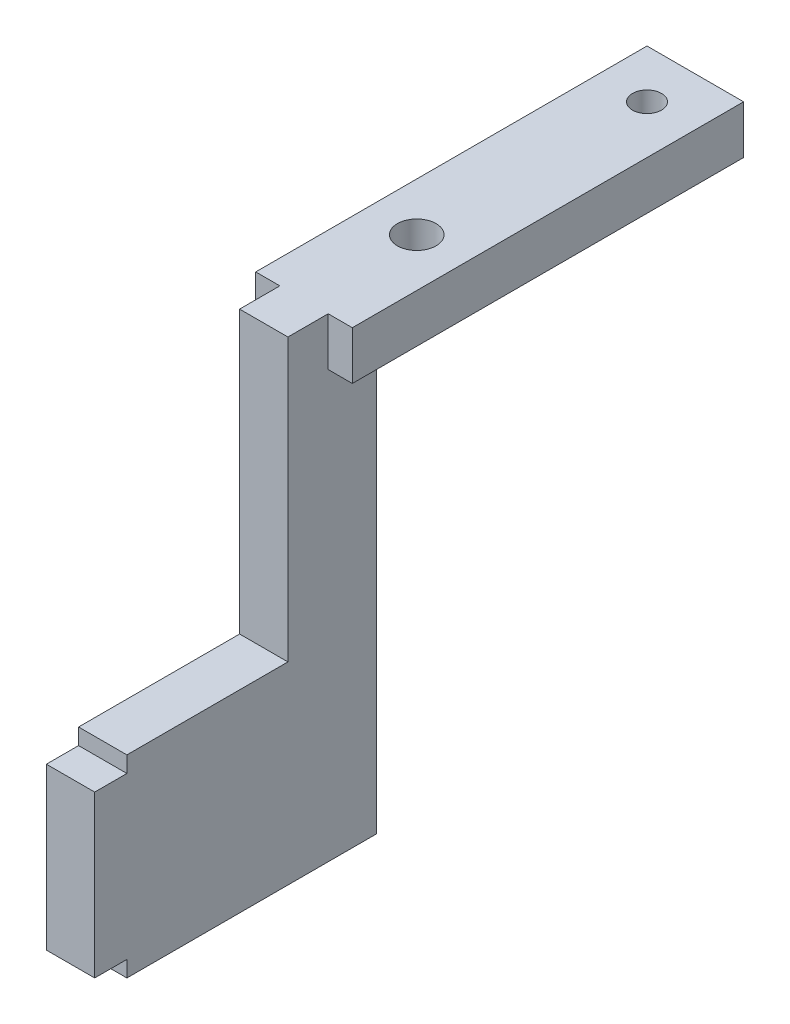
from build123d import *

# Parameters (mm, degrees)
BOSS_EXTRUDE1_START     = 7.2
SKETCH1_W               = 6
SKETCH1_H               = 3
BOSS_EXTRUDE1_DEPTH     = 24.3
BOSS_EXTRUDE2_START     = 28.5
SKETCH2_W               = 3
SKETCH2_H               = 29.475
BOSS_EXTRUDE2_DEPTH     = 17.5
CUT_EXTRUDE1_DEPTH      = 56.675089807
CUT_EXTRUDE1_DEPTH_BACK = 56.675089807
SKETCH3_R               = 1.2
SKETCH3_R_2             = 0.9
CUT_EXTRUDE2_DEPTH      = 56.675089807
CUT_EXTRUDE2_DEPTH_BACK = 56.675089807
SKETCH4_W               = 13
SKETCH4_H               = 18.475
CUT_EXTRUDE3_DEPTH      = 56.675089807
CUT_EXTRUDE3_DEPTH_BACK = 56.675089807
SKETCH5_W               = 3
SKETCH5_H               = 2.5


with BuildPart() as part:
    # Sketch1 → Boss-Extrude1 (new body)
    with BuildSketch(Plane.XY.offset(BOSS_EXTRUDE1_START)):
        with Locations((17.8, 21.975)):
            Rectangle(SKETCH1_W, SKETCH1_H)
    extrude(amount=BOSS_EXTRUDE1_DEPTH)

    # Sketch2 → Boss-Extrude2 (add)
    with BuildSketch(Plane.XY.offset(BOSS_EXTRUDE2_START)):
        with Locations((17.8, 8.7375)):
            Rectangle(SKETCH2_W, SKETCH2_H)
    extrude(amount=BOSS_EXTRUDE2_DEPTH)

    # Sketch3 → Cut-Extrude1 (cut, two sides: drawn at the far end of the back side and taken through both)
    with BuildSketch(Plane(origin=(0, 0, 0), x_dir=(1, 0, 0), z_dir=(0, 1, 0)).offset(-CUT_EXTRUDE1_DEPTH_BACK)):
        with Locations(Location((17.8, -24.5, 0), (0, 0, 270))):
            Circle(SKETCH3_R)
        with Locations(Location((17.8, -10.2, 0), (0, 0, 270))):
            Circle(SKETCH3_R_2)
    extrude(amount=CUT_EXTRUDE1_DEPTH + CUT_EXTRUDE1_DEPTH_BACK, mode=Mode.SUBTRACT)

    # Sketch4 → Cut-Extrude2 (cut, two sides: drawn at the far end of the back side and taken through both)
    with BuildSketch(Plane(origin=(0, 0, 0), x_dir=(0, 0, -1), z_dir=(1, 0, 0)).offset(-CUT_EXTRUDE2_DEPTH_BACK)):
        with Locations((-40.5, 15.2375)):
            Rectangle(SKETCH4_W, SKETCH4_H)
    extrude(amount=CUT_EXTRUDE2_DEPTH + CUT_EXTRUDE2_DEPTH_BACK, mode=Mode.SUBTRACT)

    # Sketch5 → Cut-Extrude3 (cut, two sides: drawn at the far end of the back side and taken through both)
    with BuildSketch(Plane(origin=(0, 0, 0), x_dir=(0, 0, -1), z_dir=(1, 0, 0)).offset(-CUT_EXTRUDE3_DEPTH_BACK)):
        with Locations((-45.5, -6.25)):
            Rectangle(SKETCH5_W, SKETCH5_H)
        with Locations((-45.5, 6.25)):
            Rectangle(SKETCH5_W, SKETCH5_H)
    extrude(amount=CUT_EXTRUDE3_DEPTH + CUT_EXTRUDE3_DEPTH_BACK, mode=Mode.SUBTRACT)


solid = part.part
